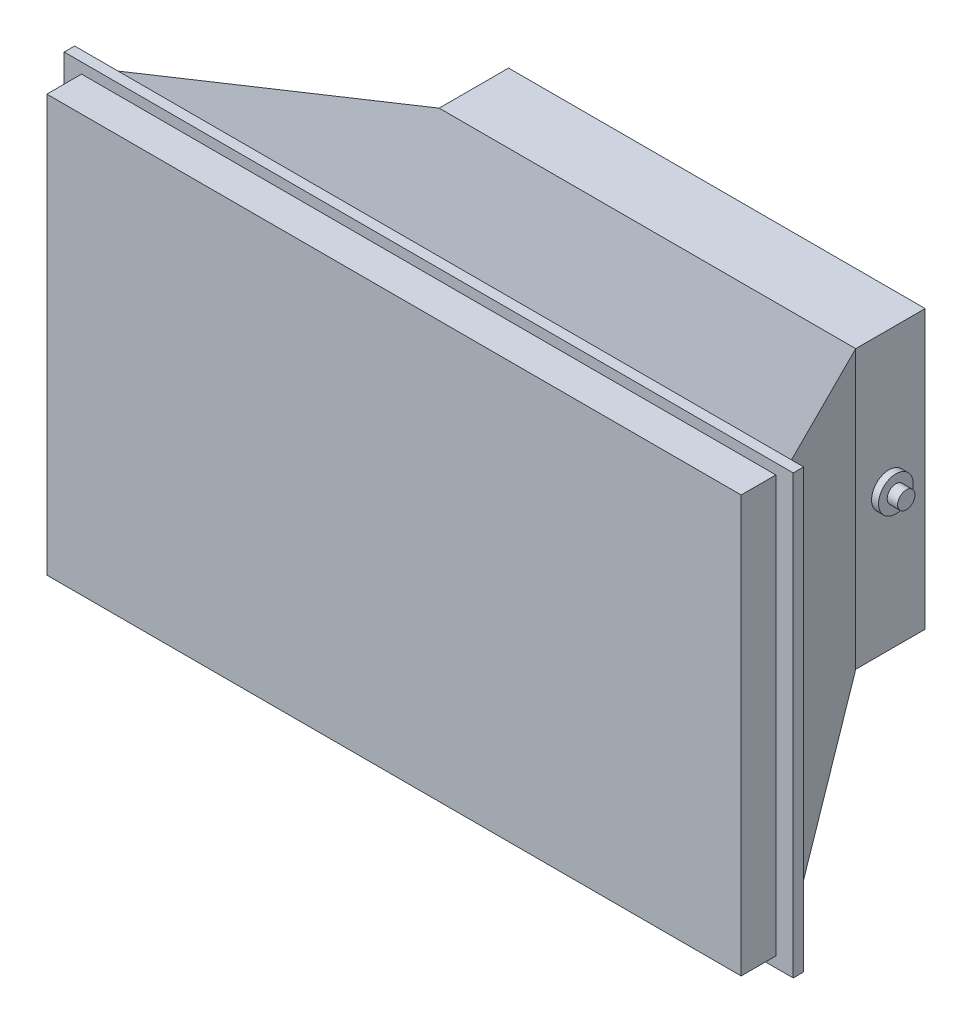
from build123d import *

# Parameters (mm, degrees)
SKETCH_2_W      = 200
SKETCH_2_H      = 120
EXTRUDE_1_DEPTH = 10
SKETCH_3_W      = 210
SKETCH_3_H      = 126
EXTRUDE_2_DEPTH = 3
SKETCH_8_W      = 120
SKETCH_8_H      = 80
EXTRUDE_4_DEPTH = 20
SKETCH_9_R      = 5
EXTRUDE_5_DEPTH = 2
SKETCH_10_R     = 2.5
EXTRUDE_6_DEPTH = 3


with BuildPart() as part:
    # 草图2 → 凸台-拉伸1 (new body)
    with BuildSketch(Plane.XY):
        Rectangle(SKETCH_2_W, SKETCH_2_H)
    extrude(amount=-EXTRUDE_1_DEPTH)

    # 草图3 → 凸台-拉伸2 (add)
    with BuildSketch(Plane(origin=(0, 0, -10), x_dir=(-1, 0, 0), z_dir=(0, 0, -1))):
        Rectangle(SKETCH_3_W, SKETCH_3_H)
    extrude(amount=EXTRUDE_2_DEPTH)

    # 草图5 → 放样2 section 0
    with BuildSketch(Plane(origin=(0, 0, -13), x_dir=(-1, 0, 0), z_dir=(0, 0, -1))):
        with BuildLine():
            Line((-100, 60), (100, 60))
            Line((100, 60), (100, -60))
            Line((100, -60), (-100, -60))
            Line((-100, -60), (-100, 60))
        make_face()
    # 草图4 → 放样2 section 1
    with BuildSketch(Plane(origin=(0, 0, -73), x_dir=(-1, 0, 0), z_dir=(0, 0, -1))):
        with BuildLine():
            Line((-60, 40), (60, 40))
            Line((60, 40), (60, -40))
            Line((60, -40), (-60, -40))
            Line((-60, -40), (-60, 40))
        make_face()
    loft()

    # 草图8 → 凸台-拉伸4 (add)
    with BuildSketch(Plane(origin=(0, 0, -73), x_dir=(-1, 0, 0), z_dir=(0, 0, -1))):
        Rectangle(SKETCH_8_W, SKETCH_8_H)
    extrude(amount=EXTRUDE_4_DEPTH)

    # 草图9 → 凸台-拉伸5 (add)
    with BuildSketch(Plane(origin=(60, 0, 0), x_dir=(0, 0, -1), z_dir=(1, 0, 0))):
        with Locations(Location((82.568018159, 0, 0), (0, 0, 180))):
            Circle(SKETCH_9_R)
    extrude_5 = extrude(amount=EXTRUDE_5_DEPTH)

    # 草图10 → 凸台-拉伸6 (add)
    with BuildSketch(Plane(origin=(62, 0, 0), x_dir=(0, 0, -1), z_dir=(1, 0, 0))):
        with Locations((82.568018159, 0)):
            Circle(SKETCH_10_R)
    extrude_6 = extrude(amount=EXTRUDE_6_DEPTH)

    # 镜向1: 凸台-拉伸5, 凸台-拉伸6 across plane
    add(extrude_5.mirror(Plane(origin=(0, 0, 0), x_dir=(0, 0, 1), z_dir=(1, 0, 0))))
    add(extrude_6.mirror(Plane(origin=(0, 0, 0), x_dir=(0, 0, 1), z_dir=(1, 0, 0))))


solid = part.part
